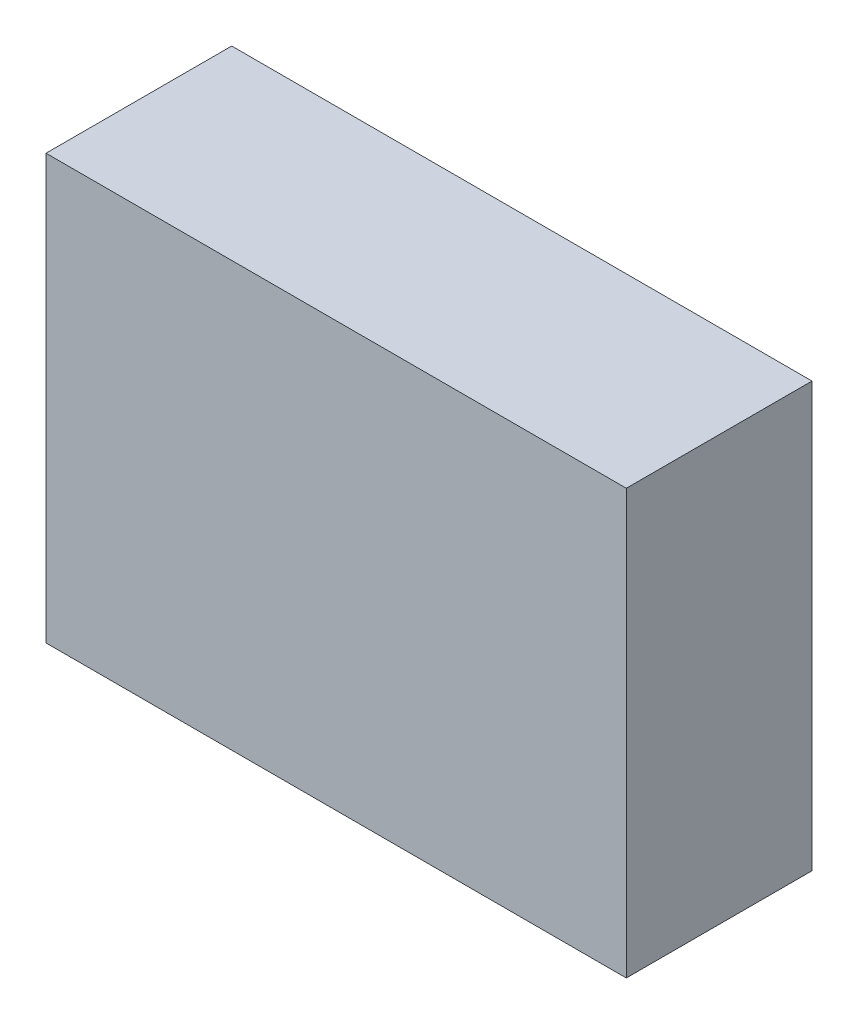
from build123d import *

# Parameters (mm, degrees)
SKETCH1_W           = 40.2
SKETCH1_H           = 55
BOSS_EXTRUDE1_DEPTH = 17.6


with BuildPart() as part:
    # Sketch1 → Boss-Extrude1 (new body)
    with BuildSketch(Plane(origin=(0, 0, 0), x_dir=(0, 1, 0), z_dir=(0, 0, 1))):
        with Locations((20.1, 27.5)):
            Rectangle(SKETCH1_W, SKETCH1_H)
    extrude(amount=BOSS_EXTRUDE1_DEPTH)


solid = part.part
